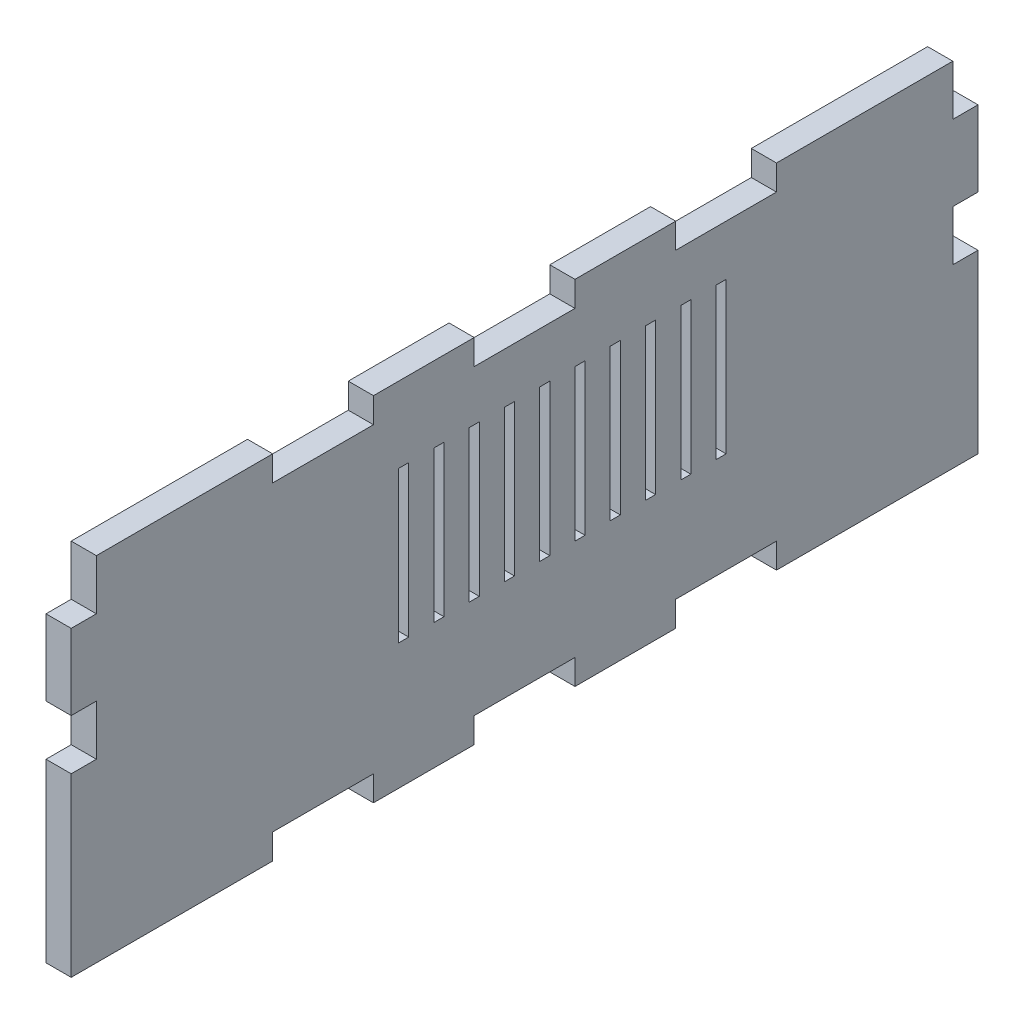
from build123d import *

# Parameters (mm, degrees)
ESQUISSE1_W             = 180
ESQUISSE1_H             = 70
BOSS_EXTRU_1_DEPTH      = 5
ESQUISSE3_W             = 5
ESQUISSE3_H             = 10
ESQUISSE3_W_2           = 20
ESQUISSE3_H_2           = 5
ENL_V_MAT_EXTRU_2_DEPTH = 5
ESQUISSE4_W             = 2
ESQUISSE4_H             = 30
ENL_V_MAT_EXTRU_3_DEPTH = 5


with BuildPart() as part:
    # Esquisse1 → Boss.-Extru.1 (new body)
    with BuildSketch(Plane(origin=(0, 0, 0), x_dir=(0, 0, -1), z_dir=(1, 0, 0))):
        Rectangle(ESQUISSE1_W, ESQUISSE1_H)
    extrude(amount=BOSS_EXTRU_1_DEPTH)

    # Esquisse3 → Enlèv. mat.-Extru.2 (cut)
    with BuildSketch(Plane(origin=(5, 0, 0), x_dir=(0, 0, -1), z_dir=(1, 0, 0))):
        with Locations((-87.5, 30)):
            Rectangle(ESQUISSE3_W, ESQUISSE3_H)
        with Locations((-87.5, 5)):
            Rectangle(ESQUISSE3_W, ESQUISSE3_H)
        with Locations((87.5, 30)):
            Rectangle(ESQUISSE3_W, ESQUISSE3_H)
        with Locations((87.5, 5)):
            Rectangle(ESQUISSE3_W, ESQUISSE3_H)
        with Locations((-40, 32.5)):
            Rectangle(ESQUISSE3_W_2, ESQUISSE3_H_2)
        with Locations((40, 32.5)):
            Rectangle(ESQUISSE3_W_2, ESQUISSE3_H_2)
        with Locations((0, 32.5)):
            Rectangle(ESQUISSE3_W_2, ESQUISSE3_H_2)
        with Locations((-40, -32.5)):
            Rectangle(ESQUISSE3_W_2, ESQUISSE3_H_2)
        with Locations((0, -32.5)):
            Rectangle(ESQUISSE3_W_2, ESQUISSE3_H_2)
        with Locations((40, -32.5)):
            Rectangle(ESQUISSE3_W_2, ESQUISSE3_H_2)
    extrude(amount=-ENL_V_MAT_EXTRU_2_DEPTH, mode=Mode.SUBTRACT)

    # Esquisse4 → Enlèv. mat.-Extru.3 (cut)
    with BuildSketch(Plane(origin=(5, 0, 0), x_dir=(0, 0, -1), z_dir=(1, 0, 0))):
        with Locations((32, 5)):
            Rectangle(ESQUISSE4_W, ESQUISSE4_H)
        with Locations((39, 5)):
            Rectangle(ESQUISSE4_W, ESQUISSE4_H)
        with Locations((25, 5)):
            Rectangle(ESQUISSE4_W, ESQUISSE4_H)
        with Locations((18, 5)):
            Rectangle(ESQUISSE4_W, ESQUISSE4_H)
        with Locations((11, 5)):
            Rectangle(ESQUISSE4_W, ESQUISSE4_H)
        with Locations((4, 5)):
            Rectangle(ESQUISSE4_W, ESQUISSE4_H)
        with Locations((-3, 5)):
            Rectangle(ESQUISSE4_W, ESQUISSE4_H)
        with Locations((-10, 5)):
            Rectangle(ESQUISSE4_W, ESQUISSE4_H)
        with Locations((-17, 5)):
            Rectangle(ESQUISSE4_W, ESQUISSE4_H)
        with Locations((-24, 5)):
            Rectangle(ESQUISSE4_W, ESQUISSE4_H)
    extrude(amount=-ENL_V_MAT_EXTRU_3_DEPTH, mode=Mode.SUBTRACT)


solid = part.part
